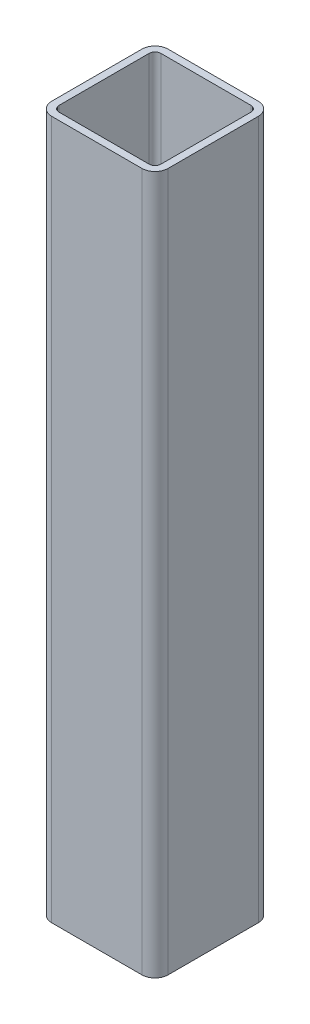
from build123d import *

# Parameters (mm, degrees)
BOSS_EXTRUDE1_DEPTH = 152.4


with BuildPart() as part:
    # Sketch1 → Boss-Extrude1 (new, symmetric)
    with BuildSketch(Plane(origin=(0, 0, 0), x_dir=(1, 0, 0), z_dir=(0, 1, 0))):
        with BuildLine():
            Line((-19.685, 25.4), (19.685, 25.4))
            ThreePointArc((19.685, 25.4), (23.726115254, 23.726115254), (25.4, 19.685))
            Line((25.4, 19.685), (25.4, -19.685))
            ThreePointArc((25.4, -19.685), (23.726115254, -23.726115254), (19.685, -25.4))
            Line((19.685, -25.4), (-19.685, -25.4))
            ThreePointArc((-19.685, -25.4), (-23.726115254, -23.726115254), (-25.4, -19.685))
            Line((-25.4, -19.685), (-25.4, 19.685))
            ThreePointArc((-25.4, 19.685), (-23.726115254, 23.726115254), (-19.685, 25.4))
        make_face()
        with BuildLine():
            Line((-19.685, -22.225), (19.685, -22.225))
            ThreePointArc((19.685, -22.225), (21.481051224, -21.481051224), (22.225, -19.685))
            Line((22.225, -19.685), (22.225, 19.685))
            ThreePointArc((22.225, 19.685), (21.481051224, 21.481051224), (19.685, 22.225))
            Line((19.685, 22.225), (-19.685, 22.225))
            ThreePointArc((-19.685, 22.225), (-21.481051224, 21.481051224), (-22.225, 19.685))
            Line((-22.225, 19.685), (-22.225, -19.685))
            ThreePointArc((-22.225, -19.685), (-21.481051224, -21.481051224), (-19.685, -22.225))
        make_face(mode=Mode.SUBTRACT)
    extrude(amount=BOSS_EXTRUDE1_DEPTH, both=True)


solid = part.part
